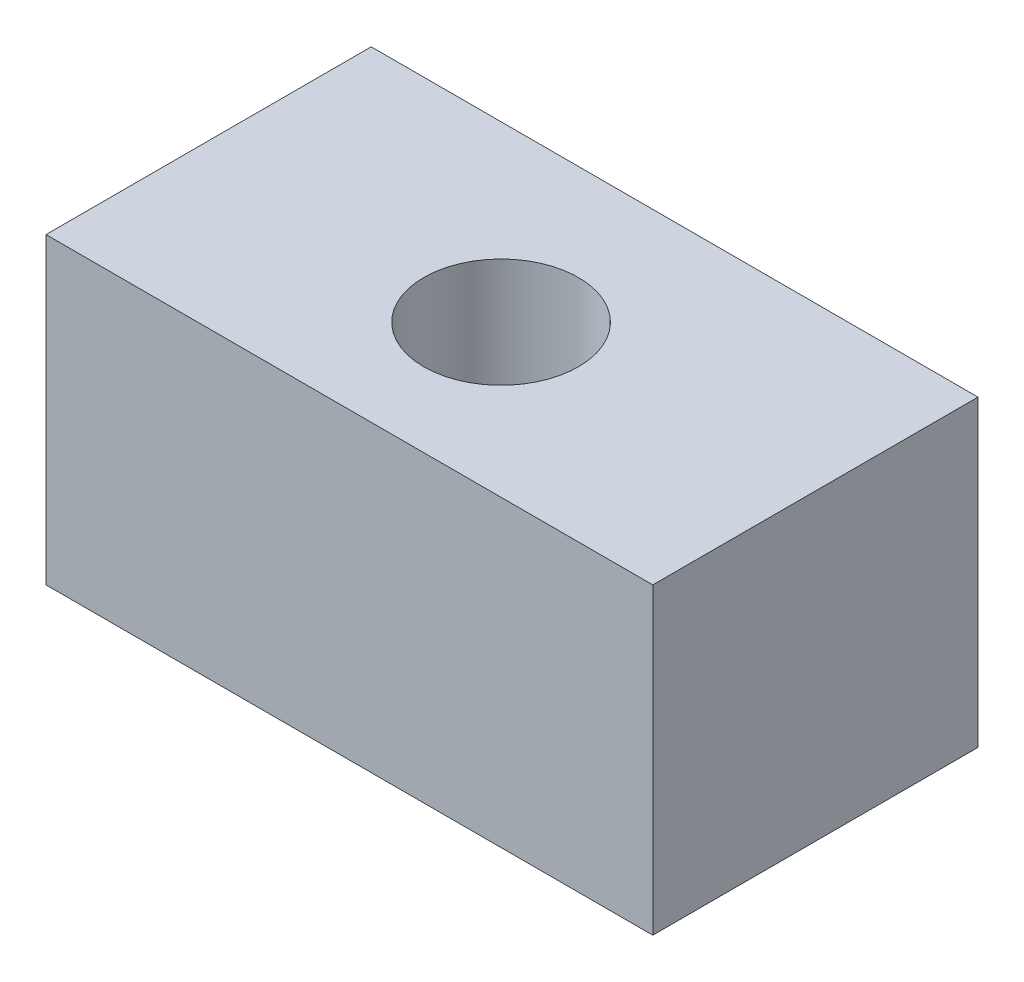
from build123d import *

# Parameters (mm, degrees)
SKETCH1_W           = 50.8
SKETCH1_H           = 25.4
BOSS_EXTRUDE1_DEPTH = 27.2288
SKETCH2_R           = 6.477
CUT_EXTRUDE1_DEPTH  = 15.24


with BuildPart() as part:
    # Sketch1 → Boss-Extrude1 (new body)
    with BuildSketch(Plane.XY):
        Rectangle(SKETCH1_W, SKETCH1_H)
    extrude(amount=BOSS_EXTRUDE1_DEPTH)

    # Sketch2 → Cut-Extrude1 (cut)
    with BuildSketch(Plane(origin=(0, 12.7, 0), x_dir=(1, 0, 0), z_dir=(0, 1, 0))):
        with Locations(Location((0, -14.5288, 0), (0, 0, 270))):
            Circle(SKETCH2_R)
    extrude(amount=-CUT_EXTRUDE1_DEPTH, mode=Mode.SUBTRACT)


solid = part.part
